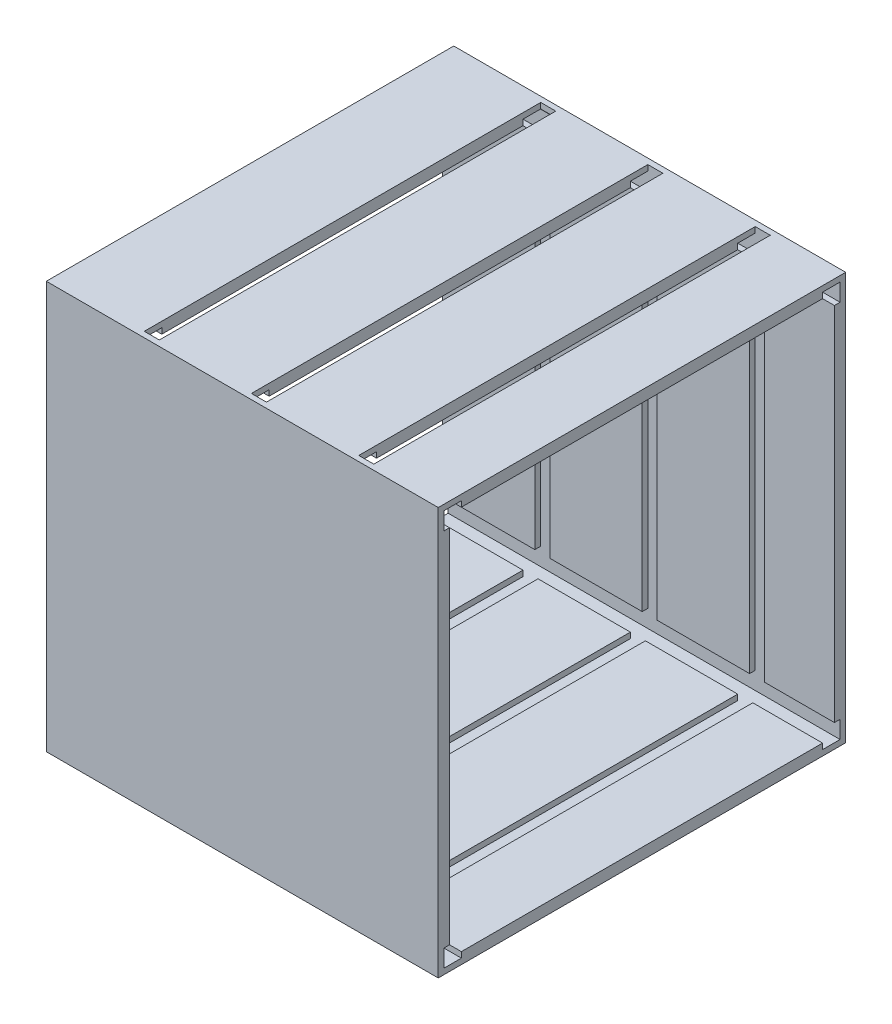
from build123d import *

# Parameters (mm, degrees)
SKETCH1_W            = 688.1
SKETCH1_H            = 688.1
SKETCH1_W_2          = 650
SKETCH1_H_2          = 650
BOSS_EXTRUDE1_DEPTH  = 661.9
SKETCH3_W            = 25.4
SKETCH3_H            = 650
CUT_EXTRUDE1_DEPTH   = 9.525
SKETCH4_W            = 25.4
SKETCH4_H            = 669.5
SKETCH4_H_2          = 669.05
CUT_EXTRUDE3_DEPTH   = 9.525
SKETCH6_W            = 25.4
SKETCH6_H            = 669.5
CUT_EXTRUDE4_DEPTH   = 9.525
CUT_EXTRUDE5_DEPTH   = 700
MIRROR6_COPY_1_DEPTH = 700


with BuildPart() as part:
    # Sketch1 → Boss-Extrude1 (new body)
    with BuildSketch(Plane(origin=(0, 0, 0), x_dir=(0, 0, -1), z_dir=(1, 0, 0))):
        with Locations((344.05, 344.05)):
            Rectangle(SKETCH1_W, SKETCH1_H)
        with Locations((344.05, 344.05)):
            Rectangle(SKETCH1_W_2, SKETCH1_H_2, mode=Mode.SUBTRACT)
    extrude(amount=BOSS_EXTRUDE1_DEPTH)

    # Sketch3 → Cut-Extrude1 (cut)
    with BuildSketch(Plane.XY.offset(-669.05)):
        with Locations((168.65, 344.05)):
            Rectangle(SKETCH3_W, SKETCH3_H)
        with Locations((350, 344.05)):
            Rectangle(SKETCH3_W, SKETCH3_H)
        with Locations((531.35, 344.05)):
            Rectangle(SKETCH3_W, SKETCH3_H)
    cut_extrude1 = extrude(amount=-CUT_EXTRUDE1_DEPTH, mode=Mode.SUBTRACT)

    # Mirror2: Cut-Extrude1 across plane
    add(cut_extrude1.mirror(Plane(origin=(0, 0, -344.05), x_dir=(1, 0, 0), z_dir=(0, 0, -1))), mode=Mode.SUBTRACT)

    # Sketch4 → Cut-Extrude3 (cut)
    with BuildSketch(Plane(origin=(0, 19.05, 0), x_dir=(1, 0, 0), z_dir=(0, 1, 0))):
        with Locations((168.65, 343.825)):
            Rectangle(SKETCH4_W, SKETCH4_H)
        with Locations((350, 343.825)):
            Rectangle(SKETCH4_W, SKETCH4_H)
        with Locations((531.35, 344.05)):
            Rectangle(SKETCH4_W, SKETCH4_H_2)
    cut_extrude3 = extrude(amount=-CUT_EXTRUDE3_DEPTH, mode=Mode.SUBTRACT)

    # Mirror4: Cut-Extrude3 across plane
    add(cut_extrude3.mirror(Plane.ZX.offset(344.05)), mode=Mode.SUBTRACT)

    # Sketch6 → Cut-Extrude4 (cut)
    with BuildSketch(Plane(origin=(0, 688.1, 0), x_dir=(1, 0, 0), z_dir=(0, 1, 0))):
        with Locations((168.65, 344.275)):
            Rectangle(SKETCH6_W, SKETCH6_H)
        with Locations((350, 343.825)):
            Rectangle(SKETCH6_W, SKETCH6_H)
        with Locations((531.35, 343.825)):
            Rectangle(SKETCH6_W, SKETCH6_H)
    extrude(amount=-CUT_EXTRUDE4_DEPTH, mode=Mode.SUBTRACT)

    # Sketch7 → Cut-Extrude5 (cut)
    with BuildSketch(Plane.ZY):
        Polygon((-19.05, 39.05), (-9.525, 39.05), (-9.525, 9.525), (-39.05, 9.525), (-39.05, 19.05), (-19.05, 19.05), align=None)
    cut_extrude5 = extrude(amount=-CUT_EXTRUDE5_DEPTH, mode=Mode.SUBTRACT)

    # Mirror5: Cut-Extrude5 across plane
    add(cut_extrude5.mirror(Plane(origin=(0, 0, -344.05), x_dir=(1, 0, 0), z_dir=(0, 0, -1))), mode=Mode.SUBTRACT)

    # Mirror6: Cut-Extrude5 across plane
    add(cut_extrude5.mirror(Plane.ZX.offset(344.05)), mode=Mode.SUBTRACT)

    # Mirror6 copy 1 sketch → Mirror6 copy 1 (cut)
    with BuildSketch(Plane(origin=(0, 688.1, -688.1), x_dir=(0, 0, -1), z_dir=(-1, 0, 0))):
        Polygon((-19.05, 39.05), (-9.525, 39.05), (-9.525, 9.525), (-39.05, 9.525), (-39.05, 19.05), (-19.05, 19.05), align=None)
    extrude(amount=-MIRROR6_COPY_1_DEPTH, mode=Mode.SUBTRACT)


solid = part.part
